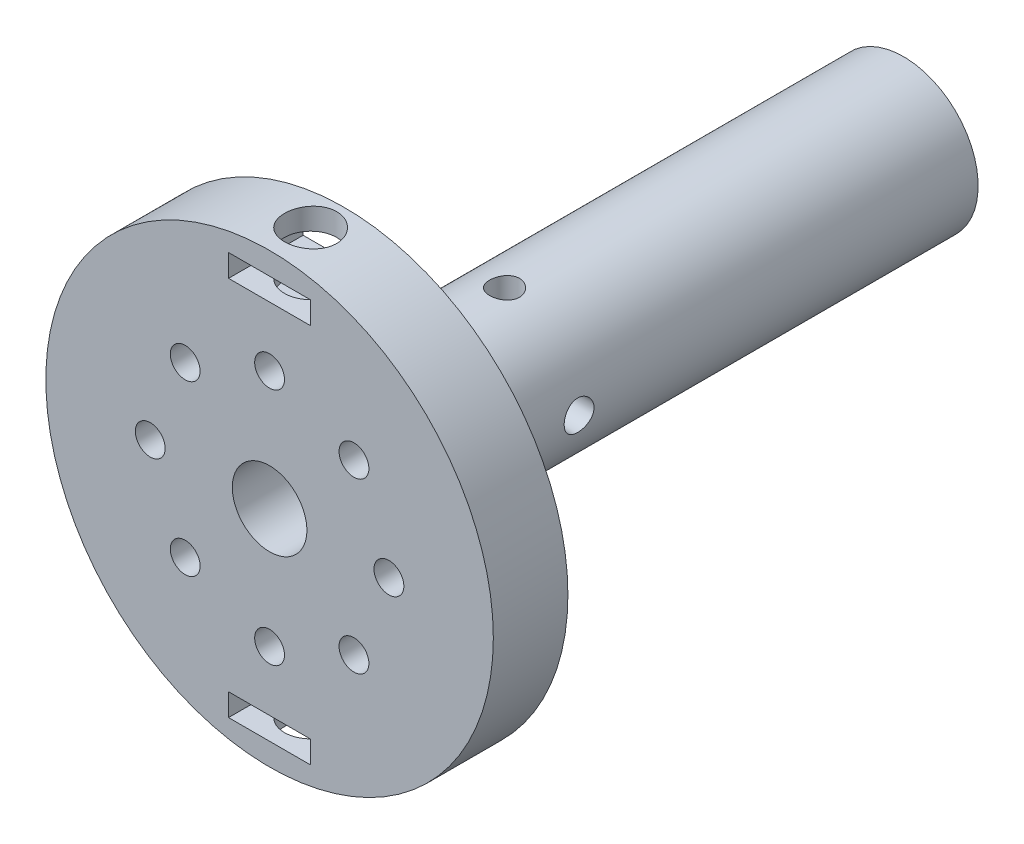
from build123d import *

# Parameters (mm, degrees)
SKETCH1_R               = 30
BOSS_EXTRUDE1_DEPTH     = 10
SKETCH2_R               = 10
BOSS_EXTRUDE2_DEPTH     = 75
SKETCH2_2_R             = 10
BOSS_EXTRUDE3_DEPTH     = 20
SKETCH5_R               = 5
CUT_EXTRUDE1_DEPTH      = 96
SKETCH6_R               = 2
CUT_EXTRUDE2_DEPTH      = 87.168439698
CIRPATTERN1_COUNT       = 2
CIRPATTERN1_ANGLE       = 90
CUT_EXTRUDE3_DEPTH      = 96.000000089
CUT_EXTRUDE3_DEPTH_BACK = 96.000000089
SKETCH7_R               = 2
SKETCH9_W               = 11
SKETCH9_H               = 3
CUT_EXTRUDE5_DEPTH      = 10
SKETCH10_R              = 3.5
CUT_EXTRUDE6_DEPTH      = 8
SKETCH17_R              = 7.355644599
BOSS_EXTRUDE4_DEPTH     = 25
SKETCH18_R              = 3
CUT_EXTRUDE7_DEPTH      = 15
BOSS_EXTRUDE5_START     = 10
BOSS_EXTRUDE5_DEPTH     = 10


with BuildPart() as part:
    # Sketch1 → Boss-Extrude1 (new body)
    with BuildSketch(Plane.XY):
        Circle(SKETCH1_R)
    extrude(amount=BOSS_EXTRUDE1_DEPTH)

    # Sketch2 → Boss-Extrude2 (add)
    with BuildSketch(Plane(origin=(0, 0, 0), x_dir=(-1, 0, 0), z_dir=(0, 0, -1))):
        Circle(SKETCH2_R)
    extrude(amount=BOSS_EXTRUDE2_DEPTH)

    # Sketch2<2> → Boss-Extrude3 (add)
    with BuildSketch(Plane(origin=(0, 0, 0), x_dir=(-1, 0, 0), z_dir=(0, 0, -1))):
        Circle(SKETCH2_2_R)
    extrude(amount=BOSS_EXTRUDE3_DEPTH)

    # Sketch5 → Cut-Extrude1 (cut, through all)
    with BuildSketch(Plane(origin=(0, 0, -75), x_dir=(-1, 0, 0), z_dir=(0, 0, -1))):
        Circle(SKETCH5_R)
    extrude(amount=-CUT_EXTRUDE1_DEPTH, mode=Mode.SUBTRACT)

    # Sketch6 → Cut-Extrude2 (cut, symmetric)
    with BuildSketch(Plane(origin=(0, 0, 0), x_dir=(1, 0, 0), z_dir=(0, 1, 0))):
        with Locations((0, 21.5)):
            Circle(SKETCH6_R)
    cut_extrude2 = extrude(amount=CUT_EXTRUDE2_DEPTH, both=True, mode=Mode.SUBTRACT)

    # CirPattern1: Cut-Extrude2 ×2 about axis
    cirpattern1_axis = Axis((0, 0, -75), (0, 0, 1))
    for i in range(1, CIRPATTERN1_COUNT):
        add(cut_extrude2.rotate(cirpattern1_axis, i * CIRPATTERN1_ANGLE / (CIRPATTERN1_COUNT - 1)), mode=Mode.SUBTRACT)

    # Sketch7 → Cut-Extrude3 (cut, two sides: drawn at the far end of the back side and taken through both)
    with BuildSketch(Plane.XY.offset(10).offset(-CUT_EXTRUDE3_DEPTH_BACK)):
        with Locations((0, 16)):
            Circle(SKETCH7_R)
        with Locations((11.313708499, 11.313708499)):
            Circle(SKETCH7_R)
        with Locations((16, 0)):
            Circle(SKETCH7_R)
        with Locations((11.313708499, -11.313708499)):
            Circle(SKETCH7_R)
        with Locations((0, -16)):
            Circle(SKETCH7_R)
        with Locations((-11.313708499, -11.313708499)):
            Circle(SKETCH7_R)
        with Locations((-16, 0)):
            Circle(SKETCH7_R)
        with Locations((-11.313708499, 11.313708499)):
            Circle(SKETCH7_R)
    extrude(amount=CUT_EXTRUDE3_DEPTH + CUT_EXTRUDE3_DEPTH_BACK, mode=Mode.SUBTRACT)

    # Sketch9 → Cut-Extrude5 (cut)
    with BuildSketch(Plane(origin=(0, 0, 0), x_dir=(-1, 0, 0), z_dir=(0, 0, -1))):
        with Locations((0, 25.5)):
            Rectangle(SKETCH9_W, SKETCH9_H)
    cut_extrude5 = extrude(amount=-CUT_EXTRUDE5_DEPTH, mode=Mode.SUBTRACT)

    # Mirror1: Cut-Extrude5 across plane
    add(cut_extrude5.mirror(Plane.ZX), mode=Mode.SUBTRACT)

    # Sketch10 → Cut-Extrude6 (cut)
    with BuildSketch(Plane(origin=(0, -30, 0), x_dir=(-1, 0, 0), z_dir=(0, -1, 0))):
        with Locations((0, -4.5)):
            Circle(SKETCH10_R)
    cut_extrude6 = extrude(amount=-CUT_EXTRUDE6_DEPTH, mode=Mode.SUBTRACT)

    # Mirror2: Cut-Extrude6 across plane
    add(cut_extrude6.mirror(Plane.ZX), mode=Mode.SUBTRACT)

    # Sketch17 → Boss-Extrude4 (add)
    with BuildSketch(Plane(origin=(0, 0, -50), x_dir=(-1, 0, 0), z_dir=(0, 0, -1))):
        Circle(SKETCH17_R)
    extrude(amount=BOSS_EXTRUDE4_DEPTH)

    # Sketch18 → Cut-Extrude7 (cut)
    with BuildSketch(Plane(origin=(0, 0, -75), x_dir=(-1, 0, 0), z_dir=(0, 0, -1))):
        Circle(SKETCH18_R)
    extrude(amount=-CUT_EXTRUDE7_DEPTH, mode=Mode.SUBTRACT)

    # Sketch19 → Boss-Extrude5 (add)
    with BuildSketch(Plane(origin=(0, 0, -60), x_dir=(-1, 0, 0), z_dir=(0, 0, -1)).offset(BOSS_EXTRUDE5_START)):
        with BuildLine():
            Line((1.658312395, 2.5), (-1.658312395, 2.5))
            ThreePointArc((-1.658312395, 2.5), (0, 3), (1.658312395, 2.5))
        make_face()
    extrude(amount=-BOSS_EXTRUDE5_DEPTH)


solid = part.part
